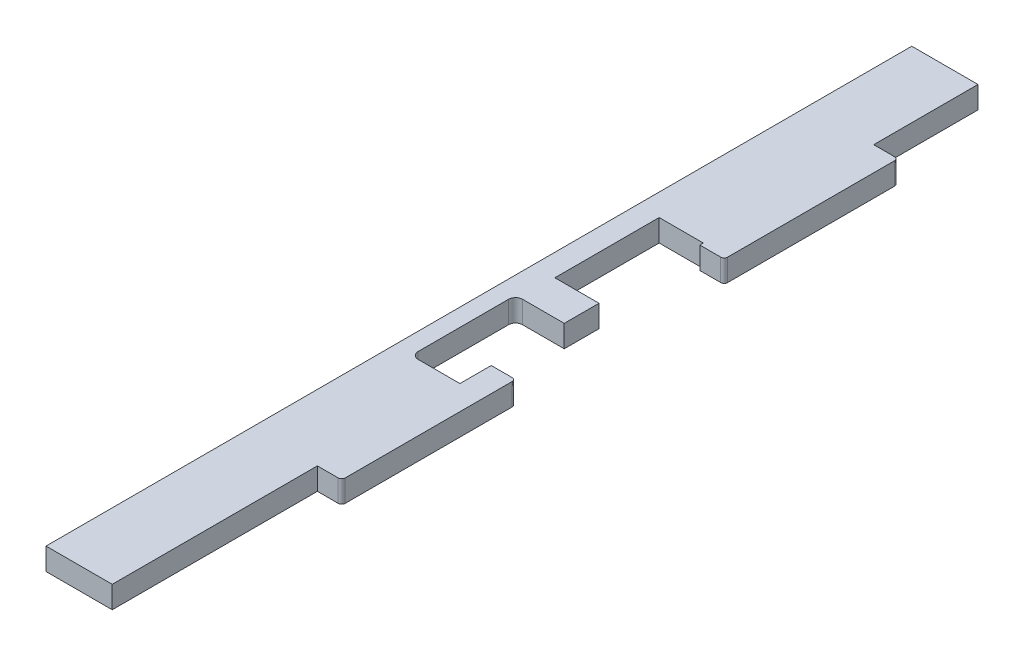
from build123d import *

# Parameters (mm, degrees)
BOSS_EXTRUDE1_DEPTH = 6.35
CUT_EXTRUDE1_DEPTH  = 212.713804804
SKETCH5_W           = 12.7
SKETCH5_H           = 30
CUT_EXTRUDE3_DEPTH  = 212.713804804


with BuildPart() as part:
    # Sketch2 → Boss-Extrude1 (new body)
    with BuildSketch(Plane(origin=(0, 0, 0), x_dir=(1, 0, 0), z_dir=(0, 1, 0))):
        with BuildLine():
            Line((-2.579558011, -38.687016575), (16.470441989, -38.687016575))
            Line((16.470441989, -38.687016575), (16.470441989, 20.312983425))
            Line((16.470441989, 20.312983425), (22.470441989, 20.312983425))
            ThreePointArc((22.470441989, 20.312983425), (23.17754877, 20.605876644), (23.470441989, 21.312983425))
            Line((23.470441989, 21.312983425), (23.470441989, 69.312983425))
            ThreePointArc((23.470441989, 69.312983425), (23.17754877, 70.020090207), (22.470441989, 70.312983425))
            Line((22.470441989, 70.312983425), (16.470441989, 70.312983425))
            Line((16.470441989, 70.312983425), (16.470441989, 130.312983425))
            Line((16.470441989, 130.312983425), (22.470441989, 130.312983425))
            ThreePointArc((22.470441989, 130.312983425), (23.17754877, 130.605876644), (23.470441989, 131.312983425))
            Line((23.470441989, 131.312983425), (23.470441989, 179.312983425))
            ThreePointArc((23.470441989, 179.312983425), (23.17754877, 180.020090207), (22.470441989, 180.312983425))
            Line((22.470441989, 180.312983425), (16.470441989, 180.312983425))
            Line((16.470441989, 180.312983425), (16.470441989, 210.312983425))
            Line((16.470441989, 210.312983425), (-2.579558011, 210.312983425))
            Line((-2.579558011, 210.312983425), (-2.579558011, -38.687016575))
        make_face()
    extrude(amount=BOSS_EXTRUDE1_DEPTH)

    # Sketch3 → Cut-Extrude1 (cut, through all)
    with BuildSketch(Plane(origin=(0, 6.35, 0), x_dir=(1, 0, 0), z_dir=(0, 1, 0))):
        with BuildLine():
            Line((16.470441989, 61.312983425), (4.470441989, 61.312983425))
            ThreePointArc((4.470441989, 61.312983425), (3.056228427, 61.898769863), (2.470441989, 63.312983425))
            Line((2.470441989, 63.312983425), (2.470441989, 89.312983425))
            ThreePointArc((2.470441989, 89.312983425), (3.056228427, 90.727196988), (4.470441989, 91.312983425))
            Line((4.470441989, 91.312983425), (16.470441989, 91.312983425))
            Line((16.470441989, 91.312983425), (16.470441989, 61.312983425))
        make_face()
    extrude(amount=-CUT_EXTRUDE1_DEPTH, mode=Mode.SUBTRACT)

    # Sketch5 → Cut-Extrude3 (cut, through all)
    with BuildSketch(Plane.XZ):
        with Locations((10.120441989, -116.312983425)):
            Rectangle(SKETCH5_W, SKETCH5_H)
    extrude(amount=-CUT_EXTRUDE3_DEPTH, mode=Mode.SUBTRACT)


solid = part.part
